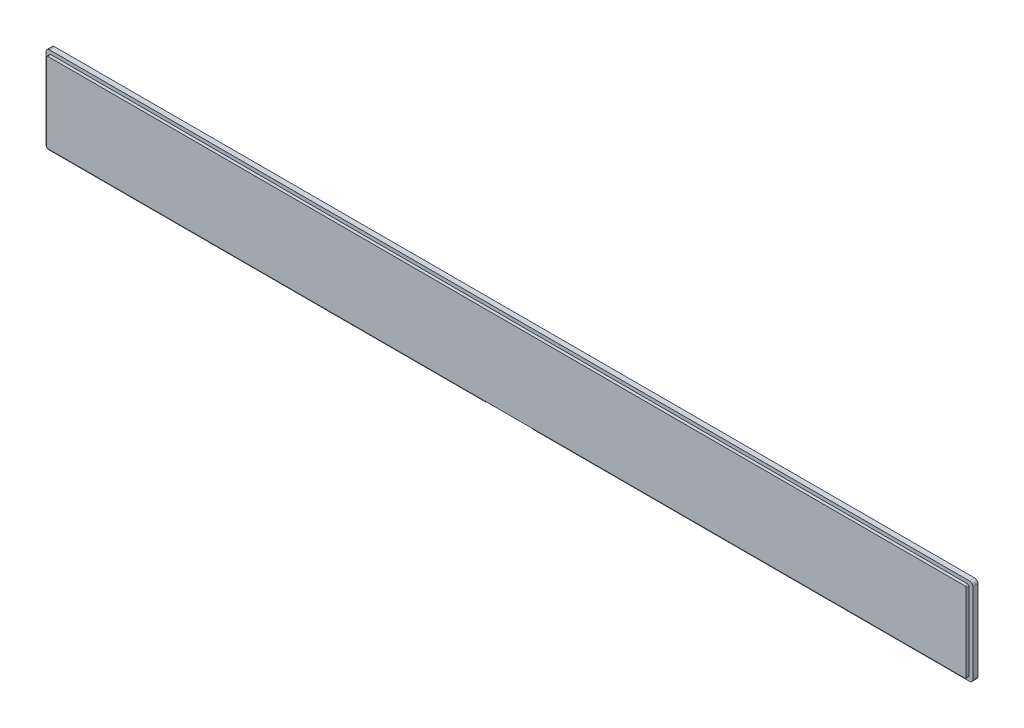
from build123d import *

# Parameters (mm, degrees)
SKICA1_W                 = 426.5
SKICA1_H                 = 40
P_IDAT_VYSUNUT_M1_DEPTH  = 2.4
SKICA2_W                 = 423.2
SKICA2_H                 = 36.8
P_IDAT_VYSUNUT_M2_DEPTH  = 1.4
ZAOBLIT1_R               = 1.5
ZAOBLIT2_R               = 0.5
ODEBRAT_VYSUNUT_M1_DEPTH = 215.199258869


with BuildPart() as part:
    # Skica1 → Přidat vysunutím1 (new body)
    with BuildSketch(Plane.XY):
        Rectangle(SKICA1_W, SKICA1_H)
    extrude(amount=P_IDAT_VYSUNUT_M1_DEPTH)

    # Skica2 → Přidat vysunutím2 (add)
    with BuildSketch(Plane.XY.offset(2.4)):
        Rectangle(SKICA2_W, SKICA2_H)
    extrude(amount=P_IDAT_VYSUNUT_M2_DEPTH)

    # Zaoblit1
    zaoblit1_edges = [part.edges().sort_by_distance(p)[0] for p in [
        (-213.25, 20, 1.2),
        (213.25, 20, 1.2),
        (213.25, -20, 1.2),
        (-213.25, -20, 1.2),
    ]]
    fillet(zaoblit1_edges, radius=ZAOBLIT1_R)

    # Zaoblit2
    zaoblit2_edges = [part.edges().sort_by_distance(p)[0] for p in [
        (211.6, -18.4, 3.1),
        (211.6, 18.4, 3.1),
        (-211.6, 18.4, 3.1),
        (-211.6, -18.4, 3.1),
    ]]
    fillet(zaoblit2_edges, radius=ZAOBLIT2_R)

    # Skica3 → Odebrat vysunutím1 (cut, through all)
    with BuildSketch(Plane.XY.offset(2.4)):
        with BuildLine():
            Line((0, -19), (-10, -19))
            ThreePointArc((-10, -19), (-10.292893219, -19.707106781), (-11, -20))
            Line((-11, -20), (-11, -20.116946074))
            Line((-11, -20.116946074), (11, -20.116946074))
            Line((11, -20.116946074), (11, -20))
            ThreePointArc((11, -20), (10.292893219, -19.707106781), (10, -19))
            Line((10, -19), (0, -19))
        make_face()
    extrude(amount=-ODEBRAT_VYSUNUT_M1_DEPTH, mode=Mode.SUBTRACT)


solid = part.part
